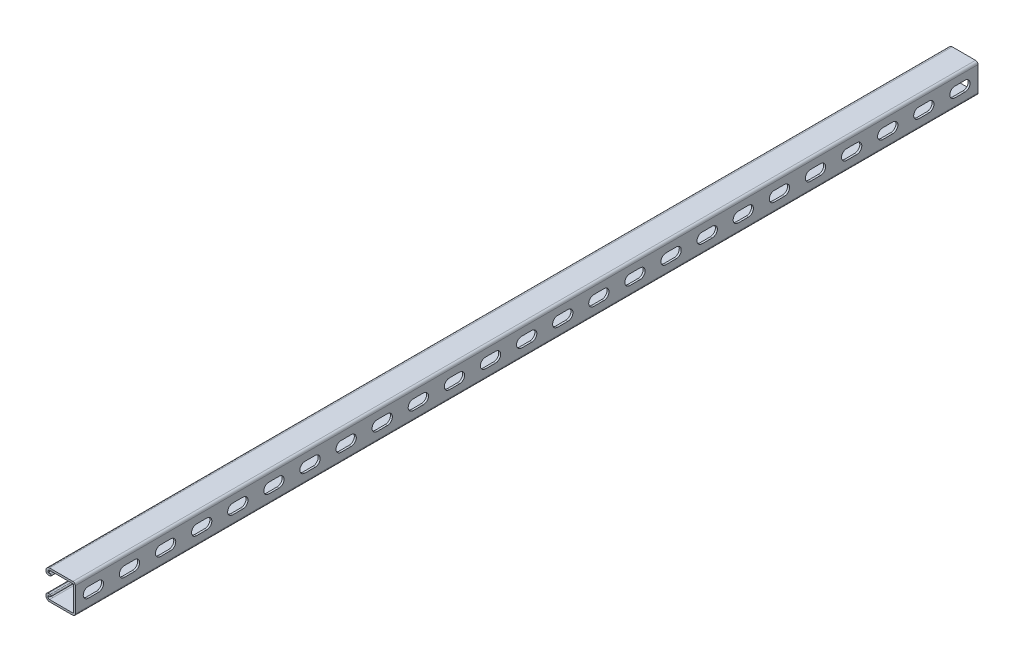
from build123d import *

# Parameters (mm, degrees)
BOSS_EXTRUDE1_DEPTH = 1270
CUT_EXTRUDE1_DEPTH  = 2.794
LPATTERN1_COUNT     = 25
LPATTERN1_PITCH     = 50.8


with BuildPart() as part:
    # Sketch1 → Boss-Extrude1 (new body)
    with BuildSketch(Plane.XY):
        with BuildLine():
            Line((-36.22675, 20.6375), (-3.46075, 20.6375))
            ThreePointArc((-3.46075, 20.6375), (-1.013630207, 19.623869793), (0, 17.17675))
            Line((0, 17.17675), (0, -17.17675))
            ThreePointArc((0, -17.17675), (-1.013630207, -19.623869793), (-3.46075, -20.6375))
            Line((-3.46075, -20.6375), (-36.22675, -20.6375))
            ThreePointArc((-36.22675, -20.6375), (-39.796401808, -19.158901808), (-41.275, -15.58925))
            Line((-41.275, -15.58925), (-41.275, -14.57325))
            ThreePointArc((-41.275, -14.57325), (-40.261369793, -12.126130207), (-37.81425, -11.1125))
            Line((-37.81425, -11.1125), (-35.5346, -11.1125))
            ThreePointArc((-35.5346, -11.1125), (-34.1376, -12.5095), (-35.5346, -13.9065))
            Line((-35.5346, -13.9065), (-37.81425, -13.9065))
            ThreePointArc((-37.81425, -13.9065), (-38.285713446, -14.101786554), (-38.481, -14.57325))
            Line((-38.481, -14.57325), (-38.481, -15.58925))
            ThreePointArc((-38.481, -15.58925), (-37.820745461, -17.183245461), (-36.22675, -17.8435))
            Line((-36.22675, -17.8435), (-3.46075, -17.8435))
            ThreePointArc((-3.46075, -17.8435), (-2.989286554, -17.648213446), (-2.794, -17.17675))
            Line((-2.794, -17.17675), (-2.794, 17.17675))
            ThreePointArc((-2.794, 17.17675), (-2.989286554, 17.648213446), (-3.46075, 17.8435))
            Line((-3.46075, 17.8435), (-36.22675, 17.8435))
            ThreePointArc((-36.22675, 17.8435), (-37.820745461, 17.183245461), (-38.481, 15.58925))
            Line((-38.481, 15.58925), (-38.481, 14.57325))
            ThreePointArc((-38.481, 14.57325), (-38.285713446, 14.101786554), (-37.81425, 13.9065))
            Line((-37.81425, 13.9065), (-35.5346, 13.9065))
            ThreePointArc((-35.5346, 13.9065), (-34.1376, 12.5095), (-35.5346, 11.1125))
            Line((-35.5346, 11.1125), (-37.81425, 11.1125))
            ThreePointArc((-37.81425, 11.1125), (-40.261369793, 12.126130207), (-41.275, 14.57325))
            Line((-41.275, 14.57325), (-41.275, 15.58925))
            ThreePointArc((-41.275, 15.58925), (-39.796401808, 19.158901808), (-36.22675, 20.6375))
        make_face()
    extrude(amount=-BOSS_EXTRUDE1_DEPTH)

    # Sketch2 → Cut-Extrude1 (cut)
    with BuildSketch(Plane(origin=(0, 0, 0), x_dir=(0, 0, -1), z_dir=(1, 0, 0))):
        with BuildLine():
            Line((18.25625, 7.14375), (32.54375, 7.14375))
            ThreePointArc((32.54375, 7.14375), (39.6875, 0), (32.54375, -7.14375))
            Line((32.54375, -7.14375), (18.25625, -7.14375))
            ThreePointArc((18.25625, -7.14375), (11.1125, 0), (18.25625, 7.14375))
        make_face()
    cut_extrude1 = extrude(amount=-CUT_EXTRUDE1_DEPTH, mode=Mode.SUBTRACT)

    # LPattern1: Cut-Extrude1 ×25
    with Locations(*[(0, 0, -i * LPATTERN1_PITCH) for i in range(1, LPATTERN1_COUNT)]):
        add(cut_extrude1, mode=Mode.SUBTRACT)


solid = part.part
